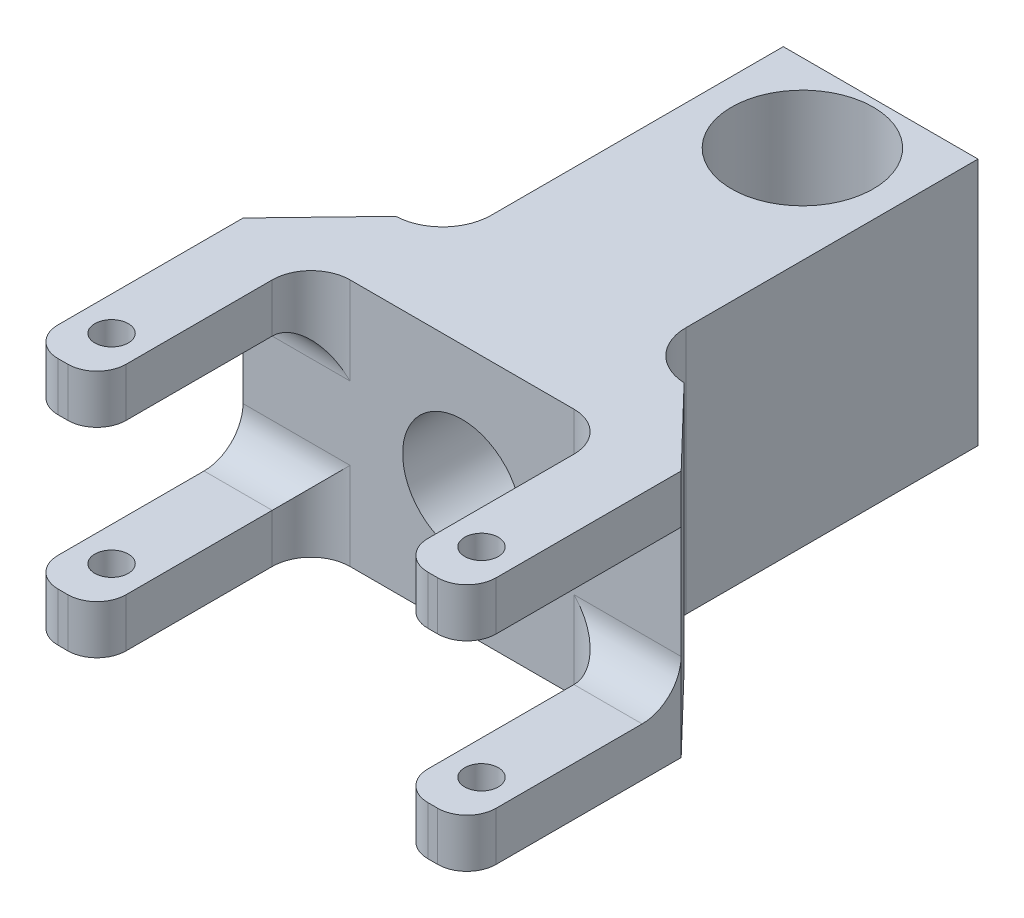
from build123d import *

# Parameters (mm, degrees)
BOSS_EXTRU_1_DEPTH                    = 25.5
ENL_V_MAT_EXTRU_1_REACH               = 52.178
ESQUISSE2_W                           = 19.17973925
ESQUISSE2_H                           = 6
ESQUISSE3_W                           = 5
ESQUISSE3_H                           = 2.04072335
BOSS_EXTRU_2_DEPTH                    = 6
ESQUISSE4_W                           = 7
ESQUISSE4_H                           = 5
BOSS_EXTRU_3_DEPTH                    = 22
ESQUISSE5_W                           = 7
ESQUISSE5_H                           = 5
BOSS_EXTRU_4_DEPTH                    = 22
ESQUISSE6_W                           = 7
ESQUISSE6_H                           = 5
BOSS_EXTRU_5_DEPTH                    = 22
ESQUISSE7_W                           = 7
ESQUISSE7_H                           = 5
BOSS_EXTRU_6_DEPTH                    = 22
D_POUILLE1_ANGLE                      = 45
D_GAGEMENT_M121_D                     = 14.566399692
D_GAGEMENT_M31_D                      = 3.44556842
D_GAGEMENT_M31_DEPTH                  = 5
D_GAGEMENT_M32_D                      = 3.44556842
D_GAGEMENT_M33_D                      = 3.44556842
D_GAGEMENT_M33_DEPTH                  = 25.5
DIAM_TRE_DU_PER_AGE_12_2_12_2_1_D     = 12.2
DIAM_TRE_DU_PER_AGE_12_2_12_2_1_DEPTH = 25
CONG_1_R                              = 3
CONG_2_R                              = 4


with BuildPart() as part:
    # Esquisse1 → Boss.-Extru.1 (new body)
    with BuildSketch(Plane(origin=(0, 12.75, 0), x_dir=(1, 0, 0), z_dir=(0, 1, 0))):
        with BuildLine():
            Line((-22.5, 0), (22.5, 0))
            Line((22.5, 0), (22.5, 0.009618943))
            Line((22.5, 0.009618943), (14.807692308, 8.003699594))
            ThreePointArc((14.807692308, 8.003699594), (11.397116539, 9.533123774), (10, 13))
            Line((10, 13), (10, 43))
            Line((10, 43), (-10, 43))
            Line((-10, 43), (-10, 13))
            ThreePointArc((-10, 13), (-11.397116539, 9.533123774), (-14.807692308, 8.003699594))
            Line((-14.807692308, 8.003699594), (-22.5, 0.009618943))
            Line((-22.5, 0.009618943), (-22.5, 0))
        make_face()
    extrude(amount=-BOSS_EXTRU_1_DEPTH)

    # Esquisse2 → Enlèv. mat.-Extru.1 (cut, up to next)
    with BuildSketch(Plane(origin=(0, 0, 0), x_dir=(0, 0, -1), z_dir=(1, 0, 0)), mode=Mode.PRIVATE) as enl_v_mat_extru_1_sk1:
        with Locations((18.410130375, -0.071525989)):
            Rectangle(ESQUISSE2_W, ESQUISSE2_H)
    enl_v_mat_extru_1_tool1 = extrude(enl_v_mat_extru_1_sk1.sketch, amount=-ENL_V_MAT_EXTRU_1_REACH, mode=Mode.PRIVATE) & part.part
    add(enl_v_mat_extru_1_tool1.solids().sort_by_distance((0, -0.071526, -18.41013))[0], mode=Mode.SUBTRACT)

    # Esquisse3 → Boss.-Extru.2 (add)
    with BuildSketch(Plane(origin=(0, -3.071525989, 0), x_dir=(-1, 0, 0), z_dir=(0, 1, 0))):
        with Locations((2.5, -26.979638325)):
            Rectangle(ESQUISSE3_W, ESQUISSE3_H)
    extrude(amount=BOSS_EXTRU_2_DEPTH)

    # Esquisse4 → Boss.-Extru.3 (add)
    with BuildSketch(Plane.XY):
        with Locations((19, 10.25)):
            Rectangle(ESQUISSE4_W, ESQUISSE4_H)
    extrude(amount=BOSS_EXTRU_3_DEPTH)

    # Esquisse5 → Boss.-Extru.4 (add)
    with BuildSketch(Plane.XY):
        with Locations((-19, 10.25)):
            Rectangle(ESQUISSE5_W, ESQUISSE5_H)
    extrude(amount=BOSS_EXTRU_4_DEPTH)

    # Esquisse6 → Boss.-Extru.5 (add)
    with BuildSketch(Plane.XY):
        with Locations((19, -10.25)):
            Rectangle(ESQUISSE6_W, ESQUISSE6_H)
    extrude(amount=BOSS_EXTRU_5_DEPTH)

    # Esquisse7 → Boss.-Extru.6 (add)
    with BuildSketch(Plane.XY):
        with Locations((-19, -10.25)):
            Rectangle(ESQUISSE7_W, ESQUISSE7_H)
    extrude(amount=BOSS_EXTRU_6_DEPTH)

    # Dépouille1
    d_pouille1_faces = [part.faces().sort_by_distance(p)[0] for p in [
        (-5, -0.071525989, -26.979638325),
    ]]
    draft(d_pouille1_faces, Plane(origin=(0, 2.928474011, -25.95927665), x_dir=(0, 1, 0), z_dir=(0, 0, 1)), D_POUILLE1_ANGLE)

    # Dégagement M121 (through all)
    with Locations(Plane(origin=(0, -12.75, 0), x_dir=(-1, 0, 0), z_dir=(0, -1, 0))):
        with Locations((0, 34.962736357)):
            Hole(D_GAGEMENT_M121_D / 2)

    # Dégagement M31
    with Locations(Plane(origin=(0, 12.75, 0), x_dir=(1, 0, 0), z_dir=(0, 1, 0))):
        with Locations((-19, -17), (19, -17)):
            Hole(D_GAGEMENT_M31_D / 2, depth=D_GAGEMENT_M31_DEPTH)

    # Dégagement M32 (through all)
    with Locations(Plane(origin=(0, -7.75, 0), x_dir=(1, 0, 0), z_dir=(0, 1, 0))):
        with Locations((19, -17)):
            Hole(D_GAGEMENT_M32_D / 2)

    # Dégagement M33
    with Locations(Plane(origin=(0, -12.75, 0), x_dir=(-1, 0, 0), z_dir=(0, -1, 0))):
        with Locations((19, -17)):
            Hole(D_GAGEMENT_M33_D / 2, depth=D_GAGEMENT_M33_DEPTH)

    # Diamètre du perçage Ø12.2 (12.2)1
    with Locations(Plane.XY):
        with Locations((0, 0)):
            Hole(DIAM_TRE_DU_PER_AGE_12_2_12_2_1_D / 2, depth=DIAM_TRE_DU_PER_AGE_12_2_12_2_1_DEPTH)

    # Congé1
    cong_1_edges = [part.edges().sort_by_distance(p)[0] for p in [
        (15.5, -10.25, 22),
        (22.5, -10.25, 22),
        (-15.5, -10.25, 22),
        (-22.5, -10.25, 22),
        (15.5, 10.25, 22),
        (22.5, 10.25, 22),
        (-22.5, 10.25, 22),
        (-15.5, 10.25, 22),
    ]]
    fillet(cong_1_edges, radius=CONG_1_R)

    # Congé2
    cong_2_edges = [part.edges().sort_by_distance(p)[0] for p in [
        (-19, -7.75, 0),
        (-15.5, -10.25, 0),
        (15.5, 10.25, 0),
        (-19, 7.75, 0),
        (-15.5, 10.25, 0),
        (19, -7.75, 0),
        (15.5, -10.25, 0),
    ]]
    fillet(cong_2_edges, radius=CONG_2_R)


solid = part.part
